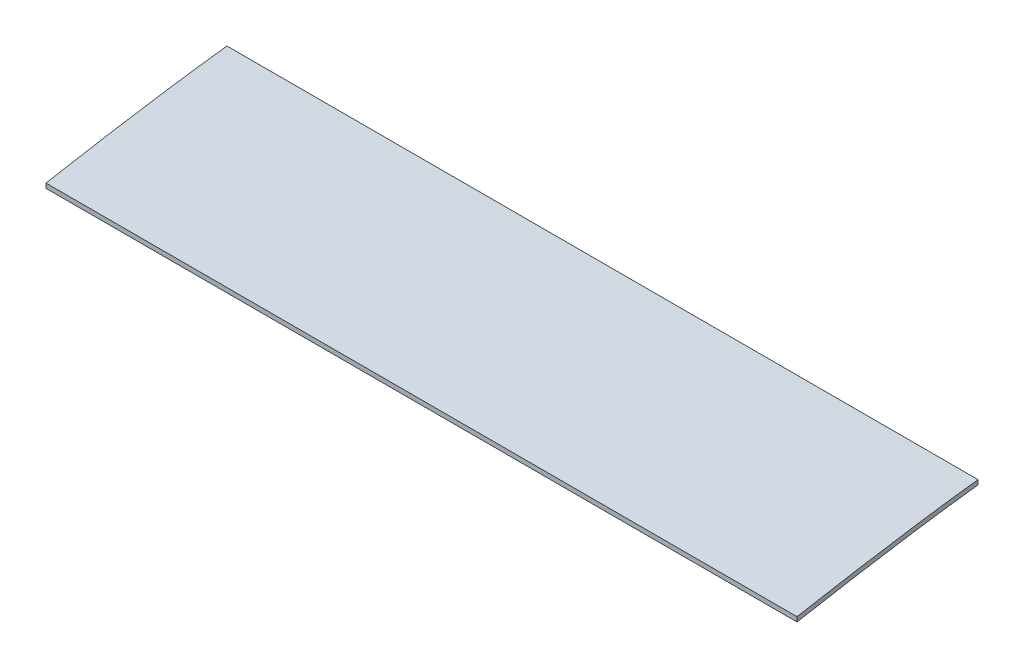
from build123d import *

# Parameters (mm, degrees)
BOSS_EXTRUDE1_DEPTH      = 263.525
BOSS_EXTRUDE1_DEPTH_BACK = 263.525


with BuildPart() as part:
    # Sketch1 → Boss-Extrude1 (new, two sides: drawn at the far end of the back side and taken through both)
    with BuildSketch(Plane(origin=(0, 0, 0), x_dir=(0, 0, -1), z_dir=(1, 0, 0)).offset(-BOSS_EXTRUDE1_DEPTH_BACK)):
        with BuildLine():
            Line((485.921053399, -45.602110236), (485.921053399, -48.829550557))
            add(Edge.make_bspline(
                [(485.921053399, -48.829550557), (497.466005268, -46.721675175), (523.823945542, -42.037523579), (564.588870456, -35.422796347), (595.412917757, -31.146245949), (611.376025813, -29.196049484), (612.921053399, -29.009843782)],
                knots=[0.62724109, 0.62724109, 0.62724109, 0.62724109, 0.668437534, 0.721214466, 0.772202341, 0.777664958, 0.777664958, 0.777664958, 0.777664958], degree=3))
            Line((612.921053399, -29.009843782), (612.921053399, -25.811919895))
            add(Edge.make_bspline(
                [(485.921053399, -45.602110236), (490.303697996, -44.802632353), (507.02215929, -41.783900307), (540.452640089, -36.019432645), (574.002925287, -30.879417835), (599.639035022, -27.451104082), (608.491793216, -26.344535138), (612.921053399, -25.811919895)],
                knots=[0.627918803, 0.627918803, 0.627918803, 0.627918803, 0.643543803, 0.6875, 0.746861687, 0.762486687, 0.778111687, 0.778111687, 0.778111687, 0.778111687], degree=3))
        make_face()
    extrude(amount=BOSS_EXTRUDE1_DEPTH + BOSS_EXTRUDE1_DEPTH_BACK)


solid = part.part
